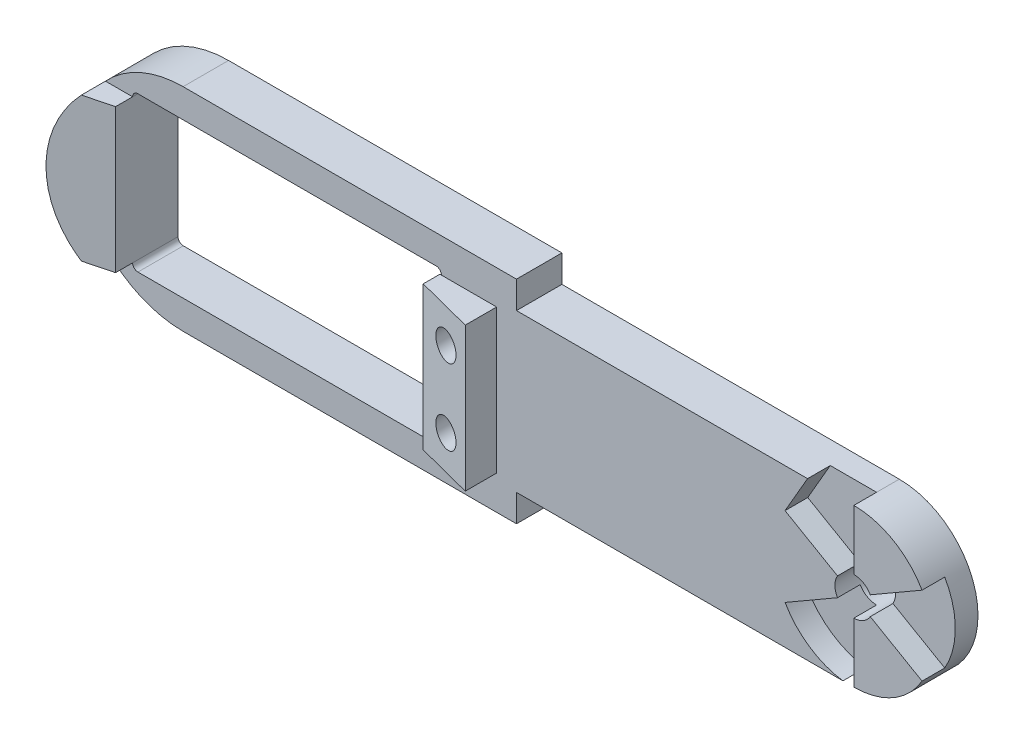
from build123d import *

# Parameters (mm, degrees)
SKETCH1_R            = 2.5
BOSS_EXTRUDE1_DEPTH  = 6
CUT_EXTRUDE4_START   = -3
CUT_EXTRUDE4_DEPTH   = 3
BOSS_EXTRUDE3_START  = -6
BOSS_EXTRUDE3_DEPTH  = 6
BOSS_EXTRUDE4_DEPTH  = 6
CUT_EXTRUDE8_DEPTH   = 216.487496567
BOSS_EXTRUDE5_REACH  = 217.487
M3_CLEARANCE_HOLE2_D = 3.6
BOSS_EXTRUDE6_REACH  = 217.487


with BuildPart() as part:
    # Sketch1 → Boss-Extrude1 (new body)
    with BuildSketch(Plane.XY):
        with BuildLine():
            Line((173.900000276, 87.099556458), (88.800000276, 87.099467009))
            ThreePointArc((88.800000276, 87.099467009), (78.399532162, 97.499935123), (88.800000276, 107.900403236))
            Line((88.800000276, 107.900403236), (173.900000276, 107.900313787))
            ThreePointArc((173.900000276, 107.900313787), (184.30037894, 97.499940589), (173.900000276, 87.099556458))
        make_face()
        with Locations((88.800000276, 97.499935123)):
            Circle(SKETCH1_R, mode=Mode.SUBTRACT)
        with Locations((173.900000276, 97.499935123)):
            Circle(SKETCH1_R, mode=Mode.SUBTRACT)
    extrude(amount=BOSS_EXTRUDE1_DEPTH)

    # Sketch2 → Cut-Extrude4 (cut)
    with BuildSketch(Plane.XY.offset(6).offset(CUT_EXTRUDE4_START)):
        with BuildLine():
            ThreePointArc((176.065063128, 98.749936261), (176.400000276, 97.499936437), (176.065064442, 96.249936261))
            Line((176.065064442, 96.249936261), (182.993597708, 92.24975057))
            ThreePointArc((182.993597708, 92.24975057), (184.40037894, 97.499940641), (182.993592189, 102.750129234))
            Line((182.993592189, 102.750129234), (176.065063128, 98.749936261))
        make_face()
        with BuildLine():
            ThreePointArc((164.806408362, 92.249741011), (168.649815723, 88.406337691), (173.900005794, 86.999556458))
            Line((173.900005794, 86.999556458), (173.90000159, 94.999935123))
            ThreePointArc((173.90000159, 94.999935123), (172.650001414, 95.334870956), (171.734937423, 96.249933985))
            Line((171.734937423, 96.249933985), (164.806408362, 92.249741011))
        make_face()
        with BuildLine():
            Line((173.899998962, 99.999935123), (173.899994757, 108.000313787))
            Line((173.899994757, 108.000313787), (167.779868906, 107.90032022))
            Line((167.779868906, 107.90032022), (164.806402844, 102.750119676))
            Line((164.806402844, 102.750119676), (171.73493611, 98.749933985))
            ThreePointArc((171.73493611, 98.749933985), (172.649999138, 99.664997975), (173.899998962, 99.999935123))
        make_face()
    extrude(amount=CUT_EXTRUDE4_DEPTH, mode=Mode.SUBTRACT)

    # Sketch4 → Boss-Extrude3 (add)
    with BuildSketch(Plane.XY.offset(6).offset(BOSS_EXTRUDE3_START)):
        with BuildLine():
            Line((85.800000276, 107.900403236), (88.800000276, 107.900403236))
            ThreePointArc((88.800000276, 107.900403236), (78.399532162, 97.499935123), (88.800000276, 87.099467009))
            Line((88.800000276, 87.099467009), (85.800000276, 87.099467009))
            ThreePointArc((85.800000276, 87.099467009), (75.399532162, 97.499935123), (85.800000276, 107.900403236))
        make_face()
    extrude(amount=BOSS_EXTRUDE3_DEPTH)

    # Sketch9 → Boss-Extrude4 (add)
    with BuildSketch(Plane.XY.offset(6)):
        with BuildLine():
            Line((85.2774961, 111.499917036), (129.322504452, 111.499917036))
            Line((129.322504452, 111.499917036), (129.322504452, 83.49995321))
            Line((129.322504452, 83.49995321), (85.322504452, 83.49995321))
            ThreePointArc((85.322504452, 83.49995321), (71.300018363, 97.477430947), (85.2774961, 111.499917036))
        make_face()
    extrude(amount=-BOSS_EXTRUDE4_DEPTH)

    # Sketch8 → Cut-Extrude8 (cut, through all)
    with BuildSketch(Plane.XY.offset(6)):
        with BuildLine():
            Line((78.600000246, 87.999935155), (78.600000306, 106.999935155))
            ThreePointArc((78.600000306, 106.999935155), (78.805025561, 107.494909902), (79.300000309, 107.699935153))
            Line((79.300000309, 107.699935153), (118.700000309, 107.699935027))
            ThreePointArc((118.700000309, 107.699935027), (119.194975055, 107.494909772), (119.400000306, 106.999935025))
            Line((119.400000306, 106.999935025), (119.400000246, 87.999935025))
            ThreePointArc((119.400000246, 87.999935025), (119.194974991, 87.504960279), (118.700000243, 87.299935027))
            Line((118.700000243, 87.299935027), (79.300000243, 87.299935153))
            ThreePointArc((79.300000243, 87.299935153), (78.805025497, 87.504960408), (78.600000246, 87.999935155))
        make_face()
    extrude(amount=-CUT_EXTRUDE8_DEPTH, mode=Mode.SUBTRACT)

    # Boss-Extrude5: up to this plane
    boss_extrude5_end = Plane(origin=(125.750000277, 97.974935005, 9.9), z_dir=(-0.2512185729888078, 8.03898804267201e-10, 0.9679303841627594))
    # Sketch13 → Boss-Extrude5 (add, up to the surface)
    with BuildSketch(Plane.XY.offset(6), mode=Mode.PRIVATE) as boss_extrude5_sk1:
        Polygon((119.200000274, 96.924935025), (119.200000246, 87.999935025), (126.700000306, 87.999935025), (126.700000306, 106.999935025), (119.200000306, 106.999935025), (119.200000278, 98.074935025), align=None)
    boss_extrude5_tool1 = split(extrude(boss_extrude5_sk1.sketch, amount=BOSS_EXTRUDE5_REACH, mode=Mode.PRIVATE), bisect_by=boss_extrude5_end, keep=Keep.BOTH, mode=Mode.PRIVATE)
    add(boss_extrude5_tool1.solids().sort_by_distance((122.95, 97.499935, 6))[0])

    # M3 Clearance Hole2 (through all)
    with Locations(Plane(origin=(0, 0, 0), x_dir=(-1, 0, 0), z_dir=(0, 0, -1))):
        with Locations((-123.250000292, 102.499935013), (-123.25000026, 92.499935013)):
            Hole(M3_CLEARANCE_HOLE2_D / 2)

    # Boss-Extrude6: up to this plane
    boss_extrude6_end = Plane(origin=(72.250000277, 97.974935176, 9.9), z_dir=(0.2512185729888078, -8.038995017974768e-10, 0.9679303841627596))
    # Sketch17 → Boss-Extrude6 (add, up to the surface)
    with BuildSketch(Plane.XY.offset(6), mode=Mode.PRIVATE) as boss_extrude6_sk1:
        with BuildLine():
            Line((75.016518346, 87.999935155), (78.600000246, 87.999935155))
            Line((78.600000246, 87.999935155), (78.600000306, 106.999935155))
            Line((78.600000306, 106.999935155), (75.016518405, 106.999935155))
            ThreePointArc((75.016518405, 106.999935155), (71.300000276, 97.499935166), (75.016518346, 87.999935155))
        make_face()
    boss_extrude6_tool1 = split(extrude(boss_extrude6_sk1.sketch, amount=BOSS_EXTRUDE6_REACH, mode=Mode.PRIVATE), bisect_by=boss_extrude6_end, keep=Keep.BOTH, mode=Mode.PRIVATE)
    add(boss_extrude6_tool1.solids().sort_by_distance((75.437055, 97.499935, 6))[0])


solid = part.part
